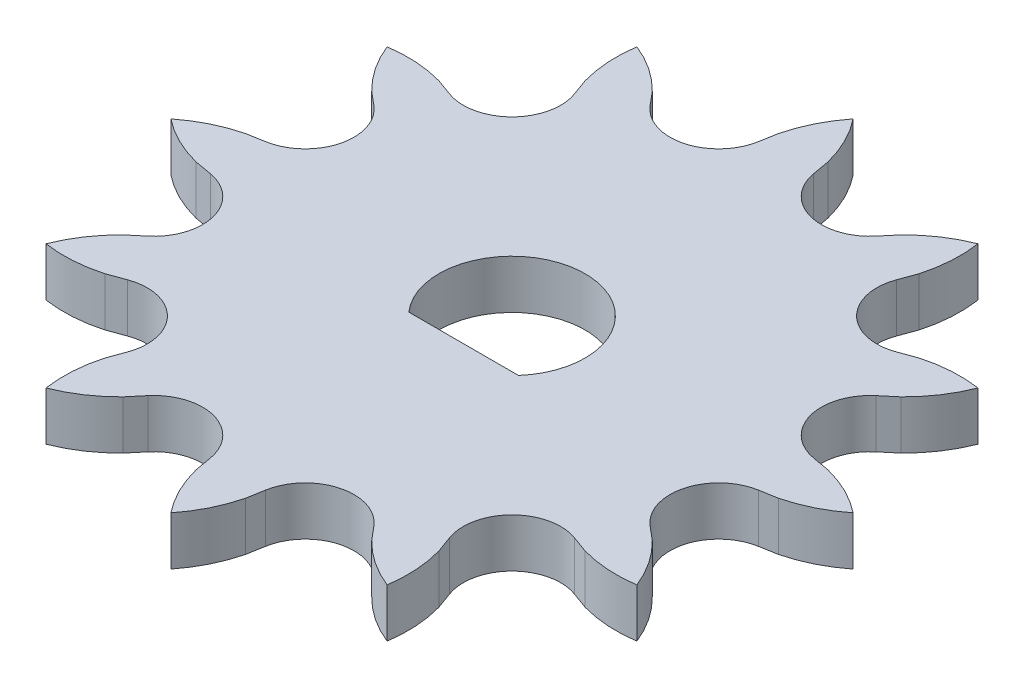
from build123d import *

# Parameters (mm, degrees)
SKETCH1_R           = 10
BOSS_EXTRUDE3_DEPTH = 2
CUT_EXTRUDE4_START  = -2
CUT_EXTRUDE4_DEPTH  = 2
CUT_EXTRUDE5_DEPTH  = 2
CUT_EXTRUDE7_START  = -2
CUT_EXTRUDE7_DEPTH  = 2


with BuildPart() as part:
    # Sketch1 → Boss-Extrude3 (new body)
    # profile 1 of 3: a face of its own
    with BuildSketch(Plane(origin=(0, 0, 0), x_dir=(1, 0, 0), z_dir=(0, 1, 0))):
        with BuildLine():
            ThreePointArc((-2.576546391, 9.66237076), (-3.696714803, 9.688501423), (-4.6270391, 10.312966622))
            Line((-4.6270391, 10.312966622), (-5.089759275, 10.867122458))
            add(Edge.make_bspline(
                [(-5.089759275, 10.867122458), (-6.64901802, 12.325915574), (-6.970753087, 12.141194398)],
                knots=[0, 0, 0, 1, 1, 1], degree=2, weights=[1, 1.687053572, 1]))
            ThreePointArc((-6.970753087, 12.141194398), (-7.014608214, -12.115909855), (14, 0))
            ThreePointArc((14, 0), (9.899494937, 9.899494937), (0, 14))
            add(Edge.make_bspline(
                [(-0.996876474, 11.958521535), (-0.370992408, 14), (0, 14)],
                knots=[0, 0, 0, 1, 1, 1], degree=2, weights=[1, 1.687053572, 1]))
            Line((-0.996876474, 11.958521535), (-1.122240194, 11.247548548))
            ThreePointArc((-1.122240194, 11.247548548), (-1.618115564, 10.242776114), (-2.576546391, 9.66237076))
        make_face()
        with BuildLine():
            ThreePointArc((10, 0), (-6.092394278, -7.9298633), (-2.576546391, 9.66237076))
            ThreePointArc((-2.576546391, 9.66237076), (6.092394278, 7.9298633), (10, 0))
        make_face(mode=Mode.SUBTRACT)
    # profile 2 of 3: a face of its own
    with BuildSketch(Plane(origin=(0, 0, 0), x_dir=(1, 0, 0), z_dir=(0, 1, 0))):
        Circle(SKETCH1_R)
    # profile 3 of 3: a face of its own
    with BuildSketch(Plane(origin=(0, 0, 0), x_dir=(1, 0, 0), z_dir=(0, 1, 0))):
        with BuildLine():
            Line((-5.089759275, 10.867122458), (-4.6270391, 10.312966622))
            ThreePointArc((-4.6270391, 10.312966622), (-3.696714803, 9.688501423), (-2.576546391, 9.66237076))
            ThreePointArc((-2.576546391, 9.66237076), (-1.618115564, 10.242776114), (-1.122240194, 11.247548548))
            Line((-1.122240194, 11.247548548), (-0.996876474, 11.958521535))
            add(Edge.make_bspline(
                [(-0.996876474, 11.958521535), (-0.370992408, 14), (0, 14)],
                knots=[0, 0, 0, 1, 1, 1], degree=2, weights=[1, 1.687053572, 1]))
            ThreePointArc((0, 14), (-3.607164983, 13.527319054), (-6.970753087, 12.141194398))
            add(Edge.make_bspline(
                [(-5.089759275, 10.867122458), (-6.64901802, 12.325915574), (-6.970753087, 12.141194398)],
                knots=[0, 0, 0, 1, 1, 1], degree=2, weights=[1, 1.687053572, 1]))
        make_face()
    extrude(amount=BOSS_EXTRUDE3_DEPTH)

    # Sketch2 → Cut-Extrude4 (cut)
    with BuildSketch(Plane(origin=(0, 2, 0), x_dir=(1, 0, 0), z_dir=(0, 1, 0)).offset(CUT_EXTRUDE4_START)):
        with BuildLine():
            Line((-1.136213035, 11.24381356), (-1.010390736, 11.95738728))
            ThreePointArc((-1.010390736, 11.95738728), (-0.613638742, 13.032335811), (0, 14))
            ThreePointArc((0, 14), (-3.623466631, 13.522961568), (-7, 12.124355653))
            ThreePointArc((-7, 12.124355653), (-5.984741166, 11.593153253), (-5.103669595, 10.860596515))
            Line((-5.103669595, 10.860596515), (-4.637917427, 10.305534696))
            ThreePointArc((-4.637917427, 10.305534696), (-2.588190451, 9.659258263), (-1.136213035, 11.24381356))
        make_face()
    extrude(amount=CUT_EXTRUDE4_DEPTH, mode=Mode.SUBTRACT)

    # Sketch3 → Cut-Extrude5 (cut)
    with BuildSketch(Plane(origin=(0, 2, 0), x_dir=(1, 0, 0), z_dir=(0, 1, 0))):
        with BuildLine():
            Line((-2.25, -1.984313483), (2.25, -1.984313483))
            ThreePointArc((2.25, -1.984313483), (0, 3), (-2.25, -1.984313483))
        make_face()
    extrude(amount=-CUT_EXTRUDE5_DEPTH, mode=Mode.SUBTRACT)

    # Sketch2<5> → Cut-Extrude7 (cut)
    with BuildSketch(Plane(origin=(0, 2, 0), x_dir=(1, 0, 0), z_dir=(0, 1, 0)).offset(CUT_EXTRUDE7_START)):
        with BuildLine():
            ThreePointArc((7, 12.124355653), (3.623466631, 13.522961568), (0, 14))
            ThreePointArc((0, 14), (0.613638742, 13.032335811), (1.010390736, 11.95738728))
            Line((1.010390736, 11.95738728), (1.136213035, 11.24381356))
            ThreePointArc((1.136213035, 11.24381356), (2.588190451, 9.659258263), (4.637917427, 10.305534696))
            Line((4.637917427, 10.305534696), (5.103669595, 10.860596515))
            ThreePointArc((5.103669595, 10.860596515), (5.984741166, 11.593153253), (7, 12.124355653))
        make_face()
        with BuildLine():
            ThreePointArc((12.124355653, 7), (9.899494937, 9.899494937), (7, 12.124355653))
            ThreePointArc((7, 12.124355653), (7.047594644, 10.979514512), (6.853717685, 9.850205779))
            Line((6.853717685, 9.850205779), (6.605896133, 9.169321661))
            ThreePointArc((6.605896133, 9.169321661), (7.071067812, 7.071067812), (9.169321661, 6.605896133))
            Line((9.169321661, 6.605896133), (9.850205779, 6.853717685))
            ThreePointArc((9.850205779, 6.853717685), (10.979514512, 7.047594644), (12.124355653, 7))
        make_face()
        with BuildLine():
            ThreePointArc((14, 0), (13.522961568, 3.623466631), (12.124355653, 7))
            ThreePointArc((12.124355653, 7), (11.593153253, 5.984741166), (10.860596515, 5.103669595))
            Line((10.860596515, 5.103669595), (10.305534696, 4.637917427))
            ThreePointArc((10.305534696, 4.637917427), (9.659258263, 2.588190451), (11.24381356, 1.136213035))
            Line((11.24381356, 1.136213035), (11.95738728, 1.010390736))
            ThreePointArc((11.95738728, 1.010390736), (13.032335811, 0.613638742), (14, 0))
        make_face()
        with BuildLine():
            ThreePointArc((-6.853717685, 9.850205779), (-7.047594644, 10.979514512), (-7, 12.124355653))
            ThreePointArc((-7, 12.124355653), (-9.899494937, 9.899494937), (-12.124355653, 7))
            ThreePointArc((-12.124355653, 7), (-10.979514512, 7.047594644), (-9.850205779, 6.853717685))
            Line((-9.850205779, 6.853717685), (-9.169321661, 6.605896133))
            ThreePointArc((-9.169321661, 6.605896133), (-7.071067812, 7.071067812), (-6.605896133, 9.169321661))
            Line((-6.605896133, 9.169321661), (-6.853717685, 9.850205779))
        make_face()
        with BuildLine():
            ThreePointArc((12.124355653, -7), (13.522961568, -3.623466631), (14, 0))
            ThreePointArc((14, 0), (13.032335811, -0.613638742), (11.95738728, -1.010390736))
            Line((11.95738728, -1.010390736), (11.24381356, -1.136213035))
            ThreePointArc((11.24381356, -1.136213035), (9.659258263, -2.588190451), (10.305534696, -4.637917427))
            Line((10.305534696, -4.637917427), (10.860596515, -5.103669595))
            ThreePointArc((10.860596515, -5.103669595), (11.593153253, -5.984741166), (12.124355653, -7))
        make_face()
        with BuildLine():
            ThreePointArc((-10.860596515, 5.103669595), (-11.593153253, 5.984741166), (-12.124355653, 7))
            ThreePointArc((-12.124355653, 7), (-13.522961568, 3.623466631), (-14, 0))
            ThreePointArc((-14, 0), (-13.032335811, 0.613638742), (-11.95738728, 1.010390736))
            Line((-11.95738728, 1.010390736), (-11.24381356, 1.136213035))
            ThreePointArc((-11.24381356, 1.136213035), (-9.659258263, 2.588190451), (-10.305534696, 4.637917427))
            Line((-10.305534696, 4.637917427), (-10.860596515, 5.103669595))
        make_face()
        with BuildLine():
            ThreePointArc((7, -12.124355653), (9.899494937, -9.899494937), (12.124355653, -7))
            ThreePointArc((12.124355653, -7), (10.979514512, -7.047594644), (9.850205779, -6.853717685))
            Line((9.850205779, -6.853717685), (9.169321661, -6.605896133))
            ThreePointArc((9.169321661, -6.605896133), (7.071067812, -7.071067812), (6.605896133, -9.169321661))
            Line((6.605896133, -9.169321661), (6.853717685, -9.850205779))
            ThreePointArc((6.853717685, -9.850205779), (7.047594644, -10.979514512), (7, -12.124355653))
        make_face()
        with BuildLine():
            ThreePointArc((-11.95738728, -1.010390736), (-13.032335811, -0.613638742), (-14, 0))
            ThreePointArc((-14, 0), (-13.522961568, -3.623466631), (-12.124355653, -7))
            ThreePointArc((-12.124355653, -7), (-11.593153253, -5.984741166), (-10.860596515, -5.103669595))
            Line((-10.860596515, -5.103669595), (-10.305534696, -4.637917427))
            ThreePointArc((-10.305534696, -4.637917427), (-9.659258263, -2.588190451), (-11.24381356, -1.136213035))
            Line((-11.24381356, -1.136213035), (-11.95738728, -1.010390736))
        make_face()
        with BuildLine():
            ThreePointArc((0, -14), (3.623466631, -13.522961568), (7, -12.124355653))
            ThreePointArc((7, -12.124355653), (5.984741166, -11.593153253), (5.103669595, -10.860596515))
            Line((5.103669595, -10.860596515), (4.637917427, -10.305534696))
            ThreePointArc((4.637917427, -10.305534696), (2.588190451, -9.659258263), (1.136213035, -11.24381356))
            Line((1.136213035, -11.24381356), (1.010390736, -11.95738728))
            ThreePointArc((1.010390736, -11.95738728), (0.613638742, -13.032335811), (0, -14))
        make_face()
        with BuildLine():
            ThreePointArc((-9.850205779, -6.853717685), (-10.979514512, -7.047594644), (-12.124355653, -7))
            ThreePointArc((-12.124355653, -7), (-9.899494937, -9.899494937), (-7, -12.124355653))
            ThreePointArc((-7, -12.124355653), (-7.047594644, -10.979514512), (-6.853717685, -9.850205779))
            Line((-6.853717685, -9.850205779), (-6.605896133, -9.169321661))
            ThreePointArc((-6.605896133, -9.169321661), (-7.071067812, -7.071067812), (-9.169321661, -6.605896133))
            Line((-9.169321661, -6.605896133), (-9.850205779, -6.853717685))
        make_face()
        with BuildLine():
            ThreePointArc((-7, -12.124355653), (-3.623466631, -13.522961568), (0, -14))
            ThreePointArc((0, -14), (-0.613638742, -13.032335811), (-1.010390736, -11.95738728))
            Line((-1.010390736, -11.95738728), (-1.136213035, -11.24381356))
            ThreePointArc((-1.136213035, -11.24381356), (-2.588190451, -9.659258263), (-4.637917427, -10.305534696))
            Line((-4.637917427, -10.305534696), (-5.103669595, -10.860596515))
            ThreePointArc((-5.103669595, -10.860596515), (-5.984741166, -11.593153253), (-7, -12.124355653))
        make_face()
    extrude(amount=CUT_EXTRUDE7_DEPTH, mode=Mode.SUBTRACT)


solid = part.part
